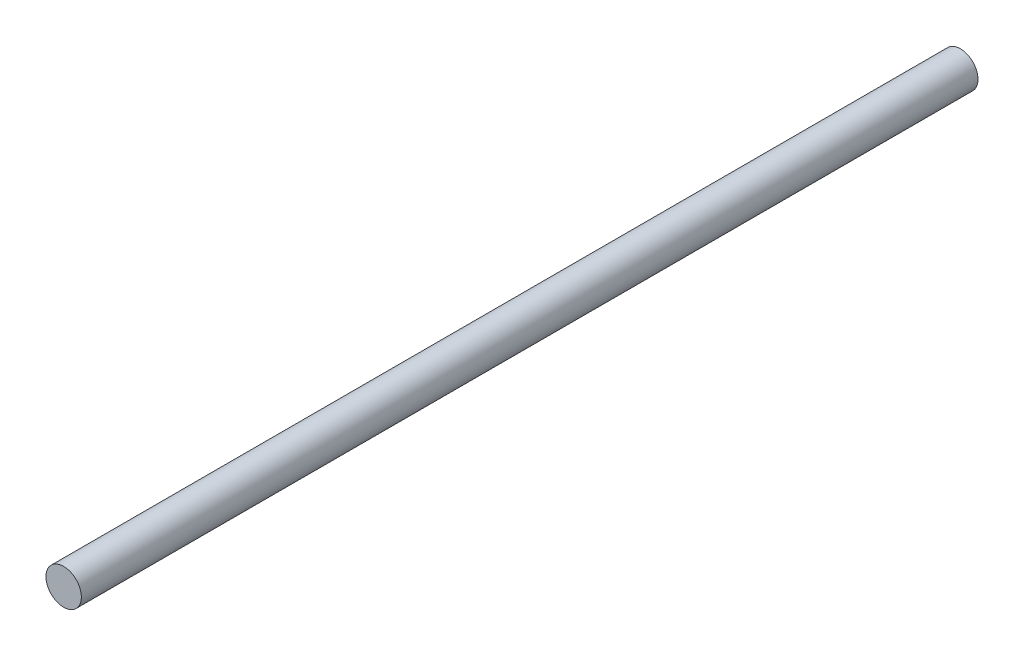
from build123d import *

# Parameters (mm, degrees)
SKETCH1_R           = 0.75
BOSS_EXTRUDE1_DEPTH = 38


with BuildPart() as part:
    # Sketch1 → Boss-Extrude1 (new body)
    with BuildSketch(Plane.XY):
        Circle(SKETCH1_R)
    extrude(amount=BOSS_EXTRUDE1_DEPTH)


solid = part.part
